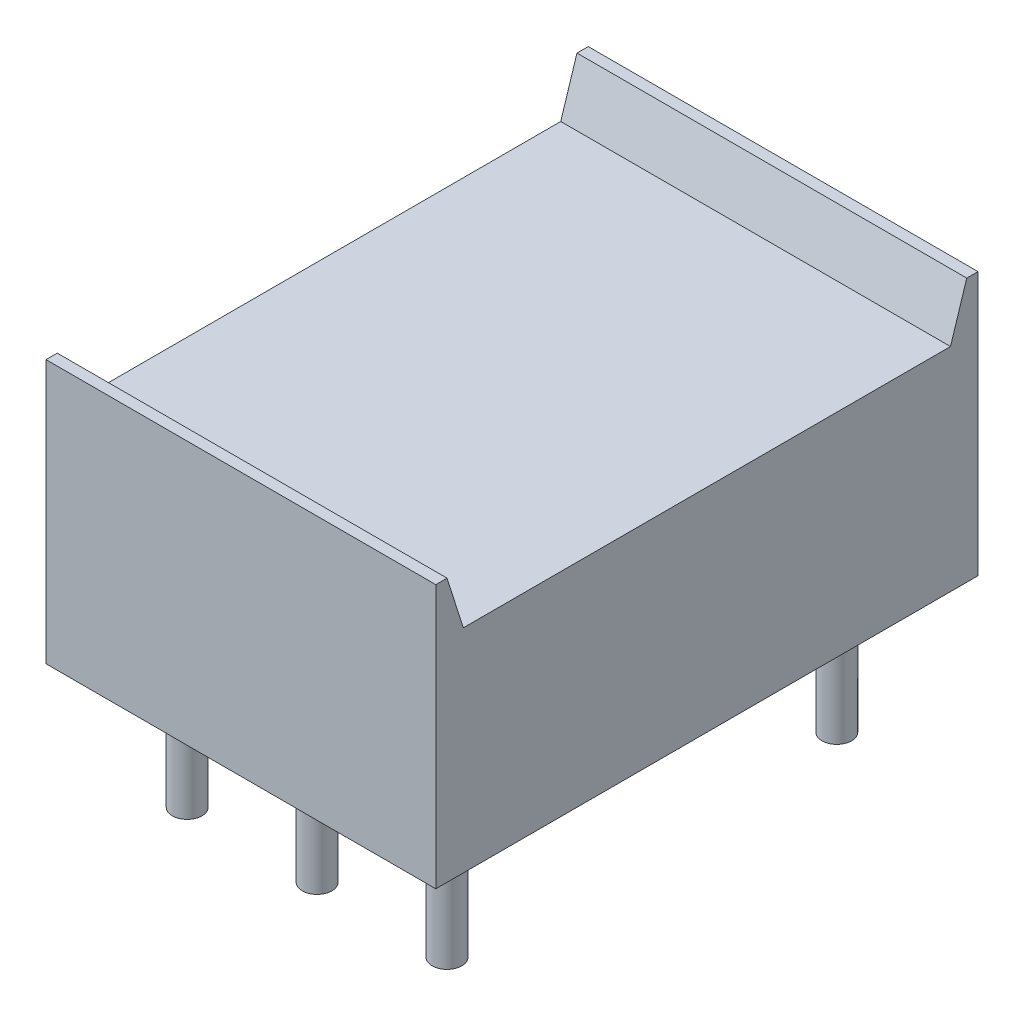
from build123d import *

# Parameters (mm, degrees)
SKETCH1_W            = 7.62
SKETCH1_H            = 10.6
BOSS_EXTRUDE1_DEPTH  = 5.15
SKETCH3_R            = 0.29
BOSS_EXTRUDE2_DEPTH  = 2.54
LPATTERN1_COUNT      = 3
LPATTERN1_PITCH      = 2.54
LPATTERN1_COUNT_DIR2 = 2
LPATTERN1_PITCH_DIR2 = 7.62
CUT_EXTRUDE1_DEPTH   = 11.614937588


with BuildPart() as part:
    # Sketch1 → Boss-Extrude1 (new body)
    with BuildSketch(Plane(origin=(0, 0, 0), x_dir=(1, 0, 0), z_dir=(0, 1, 0))):
        Rectangle(SKETCH1_W, SKETCH1_H)
    extrude(amount=BOSS_EXTRUDE1_DEPTH)

    # Sketch3 → Boss-Extrude2 (add)
    with BuildSketch(Plane.XZ):
        with Locations(Location((2.54, -3.81, 0), (0, 0, 270))):
            Circle(SKETCH3_R)
    boss_extrude2 = extrude(amount=BOSS_EXTRUDE2_DEPTH)

    # LPattern1: Boss-Extrude2 3 × 2
    with Locations(*[(-i * LPATTERN1_PITCH, 0, j * LPATTERN1_PITCH_DIR2) for i in range(LPATTERN1_COUNT) for j in range(LPATTERN1_COUNT_DIR2) if (i, j) != (0, 0)]):
        add(boss_extrude2)

    # Sketch4 → Cut-Extrude1 (cut, through all)
    with BuildSketch(Plane.ZY.offset(3.81)):
        Polygon((-5.08, 5.15), (-4.7625, 4.15), (4.7625, 4.15), (5.08, 5.15), align=None)
    extrude(amount=-CUT_EXTRUDE1_DEPTH, mode=Mode.SUBTRACT)


solid = part.part
